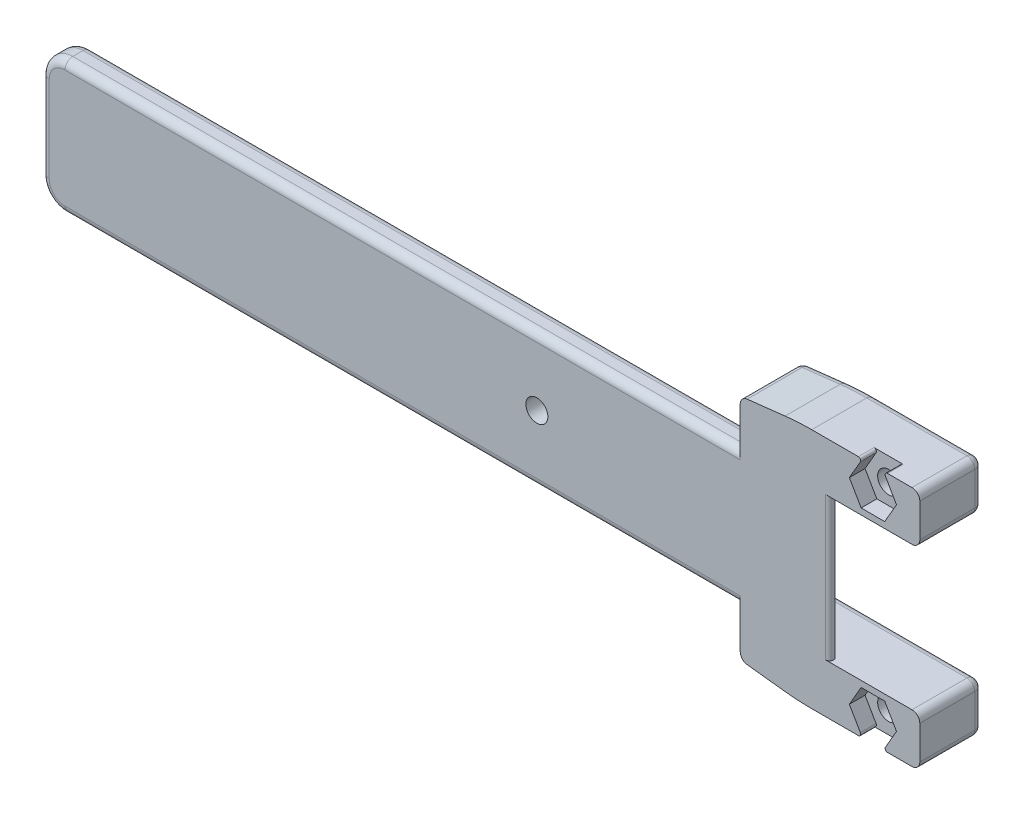
from build123d import *

# Parameters (mm, degrees)
SKETCH1_R             = 1.4000000000000001
BOSS_EXTRUDE1_DEPTH   = 8
SKETCH1_R_2           = 1.4000001329680465
BOSS_EXTRUDE1_2_DEPTH = 8
CUT_EXTRUDE1_DEPTH    = 2
BOSS_EXTRUDE2_REACH   = 38.543
FILLET1_R             = 0.3
FILLET2_R             = 0.5
SKETCH4_W             = 3.300000288709998
SKETCH4_H             = 17
BOSS_EXTRUDE3_DEPTH   = 89
FILLET3_R             = 3
FILLET4_R             = 1
FILLET5_R             = 30
FILLET6_R             = 1
FILLET7_R             = 1
SKETCH5_R             = 1.4000008127885915
CUT_EXTRUDE2_DEPTH    = 117.20130403381272


with BuildPart() as part:
    # Sketch1 → Boss-Extrude1 (new body)
    with BuildSketch(Plane.XY):
        Polygon((-3.0301585163921114, 15.386126765608788), (-18.49637259864768, 15.386126765608788), (-25.90000070631504, 14.542589808684392), (-25.90000070631504, 9.120777419209476), (-3.030158516392113, 9.12077741920948), align=None)
        with Locations((-8.999999881867154, 12.49999987202729)):
            Circle(SKETCH1_R, mode=Mode.SUBTRACT)
    extrude(amount=BOSS_EXTRUDE1_DEPTH)


with BuildPart() as body_2:
    # Sketch1 → Boss-Extrude1 2 (new body)
    with BuildSketch(Plane.XY):
        Polygon((-3.0301585163921114, -15.386126765608788), (-3.0301585163921114, -9.12077741920948), (-25.90000070631504, -9.12077741920948), (-25.90000070631504, -14.542589808684392), (-18.496372598647696, -15.386126765608788), align=None)
        with Locations((-8.999999825719202, -12.500000716819214)):
            Circle(SKETCH1_R_2, mode=Mode.SUBTRACT)
    extrude(amount=BOSS_EXTRUDE1_2_DEPTH)


with BuildPart() as cut_extrude1_tool:
    # Sketch2 → Cut-Extrude1 (new body)
    with BuildSketch(Plane.XY.offset(8)):
        Polygon((-5.997778482081098, 12.499999872027288), (-7.498889181974129, 15.099999872027293), (-8.281088680356937, 16.454809144881214), (-9.718911083377371, 16.454809144881214), (-10.501110581760184, 15.099999872027293), (-12.002221281653215, 12.499999872027287), (-10.501110581760186, 9.899999872027289), (-7.498889181974125, 9.899999872027289), align=None)
        Polygon((-7.498889125826173, -9.900000716819214), (-10.501110525612221, -9.900000716819216), (-12.002221225505249, -12.500000716819212), (-10.501110525612223, -15.100000716819206), (-9.468316266504699, -16.88885284735889), (-8.531683384933698, -16.888852847358898), (-7.498889125826177, -15.100000716819206), (-5.997778425933152, -12.500000716819208), align=None)
    extrude(amount=-CUT_EXTRUDE1_DEPTH)


with BuildPart() as part_1:
    add(part.part)

    # Cut-Extrude1: cut by cut_extrude1_tool
    add(cut_extrude1_tool.part, mode=Mode.SUBTRACT)


with BuildPart() as body_2_1:
    add(body_2.part)

    # Cut-Extrude1: cut by cut_extrude1_tool
    add(cut_extrude1_tool.part, mode=Mode.SUBTRACT)

    # Sketch3 → Boss-Extrude2 (add, up to next)
    with BuildSketch(Plane.XZ.offset(-9.12077741920948), mode=Mode.PRIVATE) as boss_extrude2_sk1:
        Polygon((-25.90000070631504, 8), (-25.90000070631504, 2.699999711290002), (-24.255957938355465, 2.6999997112900025), (-12.725226135105776, 8), (-18.496372598647696, 8), align=None)
    boss_extrude2_tool1 = extrude(boss_extrude2_sk1.sketch, amount=BOSS_EXTRUDE2_REACH, mode=Mode.PRIVATE) - body_2_1.part

    add(part_1.part)  # Boss-Extrude2 merges part
    add(boss_extrude2_tool1.solids().sort_by_distance((-21.447611, 9.120777, 6.037334))[0])

    # Fillet1
    fillet1_edges = [body_2_1.edges().sort_by_distance(p)[0] for p in [
        (-10.335915142728517, 15.386126765608788, 7),
        (-7.664084621005797, 15.386126765608788, 7),
        (-7.664084077117004, -15.386126765608788, 7),
        (-10.33591557432139, -15.386126765608788, 7),
    ]]
    fillet(fillet1_edges, radius=FILLET1_R)

    # Fillet2
    fillet2_edges = [body_2_1.edges().sort_by_distance(p)[0] for p in [
        (-12.725226135105776, 0, 8),
    ]]
    fillet(fillet2_edges, radius=FILLET2_R)

    # Sketch4 → Boss-Extrude3 (add)
    with BuildSketch(Plane.ZY.offset(25.90000070631504)):
        with Locations((6.349999855645001, 0)):
            Rectangle(SKETCH4_W, SKETCH4_H)
    extrude(amount=BOSS_EXTRUDE3_DEPTH)

    # Fillet3
    fillet3_edges = [body_2_1.edges().sort_by_distance(p)[0] for p in [
        (-114.90000070631504, 8.5, 6.349999855645001),
        (-114.90000070631504, -8.5, 6.349999855645001),
    ]]
    fillet(fillet3_edges, radius=FILLET3_R)

    # Fillet4
    fillet4_edges = [body_2_1.edges().sort_by_distance(p)[0] for p in [
        (-3.0301585163921114, 15.386126765608788, 4),
        (-3.0301585163921123, 9.12077741920948, 4),
        (-25.90000070631504, 14.542589808684392, 4),
        (-25.90000070631504, 9.120777419209476, 1.349999855645001),
        (-3.0301585163921114, -9.12077741920948, 4),
        (-25.90000070631504, -9.12077741920948, 1.349999855645001),
        (-25.90000070631504, -14.542589808684392, 4),
        (-3.0301585163921114, -15.386126765608788, 4),
    ]]
    fillet(fillet4_edges, radius=FILLET4_R)

    # Fillet5
    fillet5_edges = [body_2_1.edges().sort_by_distance(p)[0] for p in [
        (-18.49637259864768, 15.38612676560879, 4),
        (-18.496372598647696, -15.386126765608788, 4),
    ]]
    fillet(fillet5_edges, radius=FILLET5_R)

    # Fillet6
    fillet6_edges = [body_2_1.edges().sort_by_distance(p)[0] for p in [
        (-14.465079611353577, 9.120777419209478, 0),
        (-22.601074828066285, 14.918454973167087, 0),
        (-3.0301585163921114, 12.253452092409134, 0),
        (-25.90000070631504, 11.885416556829192, 0),
        (-3.323051735205564, 15.093233546795336, 0),
        (-3.3230517352055653, 9.413670638022932, 0),
        (-25.646058085143018, 14.315937356229982, 0),
        (-25.607107487501587, 9.413670638022928, 0),
        (-25.90000070631504, -11.885416556829192, 0),
        (-14.465079611353575, -9.12077741920948, 0),
        (-3.0301585163921114, -12.253452092409134, 0),
        (-10.411503745491025, -15.386126765608788, 0),
        (-3.323051735205564, -9.413670638022932, 0),
        (-3.323051735205564, -15.093233546795336, 0),
        (-25.646058085143018, -14.315937356229977, 0),
        (-25.607107487501587, -9.413670638022932, 0),
        (-22.601074828066285, -14.918454973167087, 0),
        (-18.493632770900625, -15.337876872709488, 0),
        (-10.411503745491025, 15.386126765608788, 0),
        (-18.493632770900625, 15.337876872709492, 0),
    ]]
    fillet(fillet6_edges, radius=FILLET6_R)

    # Fillet7
    fillet7_edges = [body_2_1.edges().sort_by_distance(p)[0] for p in [
        (-114.90000070631504, 1.78e-15, 8),
        (-114.90000070631504, 0, 4.699999711290002),
        (-68.90000070631504, 8.5, 8),
        (-68.90000070631504, -8.5, 8),
        (-114.02132104987469, 7.621320343559643, 8),
        (-114.02132104987469, -7.621320343559643, 8),
        (-68.90000070631504, -8.5, 4.699999711290002),
        (-68.90000070631504, 8.5, 4.699999711290002),
        (-114.02132104987469, 7.621320343559643, 4.699999711290002),
        (-114.02132104987469, -7.621320343559643, 4.699999711290002),
    ]]
    fillet(fillet7_edges, radius=FILLET7_R)

    # Sketch5 → Cut-Extrude2 (cut, through all)
    with BuildSketch(Plane.XY.offset(8)):
        with Locations((-51.80000095537239, -2.0194977255e-07)):
            Circle(SKETCH5_R)
    extrude(amount=-CUT_EXTRUDE2_DEPTH, mode=Mode.SUBTRACT)


solid = body_2_1.part
